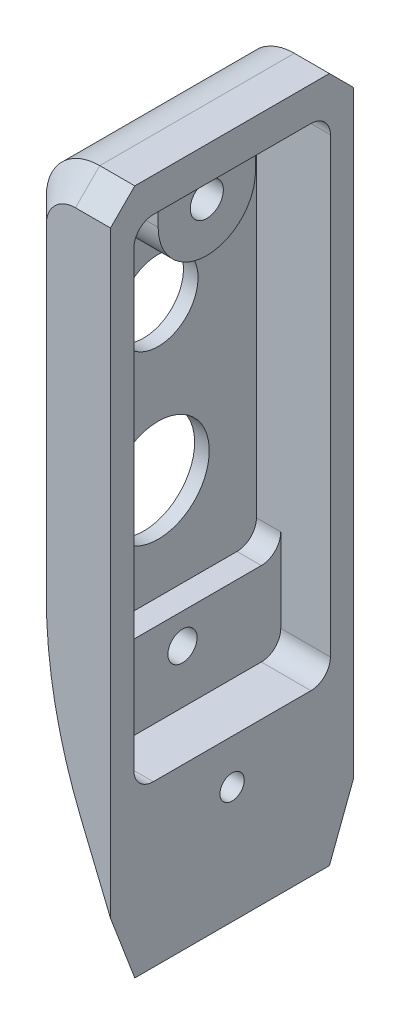
from build123d import *

# Parameters (mm, degrees)
EXTRUDE_1_DEPTH             = 25
CHAMFER_5_SIZE              = 2.5
SKETCH_6_W                  = 20.2
SKETCH_6_H                  = 41.891303575
CUT_EXTRUDE_2_DEPTH         = 7.6
SKETCH_7_R                  = 5.25
SKETCH_7_R_2                = 4.1
CUT_EXTRUDE_3_DEPTH         = 76.352903063
SKETCH_8_W                  = 20.2
SKETCH_8_H                  = 8.585894888
CUT_EXTRUDE_4_DEPTH         = 5.1
FILLET_2_R                  = 2
CUT_EXTRUDE_5_REACH         = 77.353
SKETCH_10_R                 = 1.5
M3X0_51_D                   = 2.5
M3X0_51_DEPTH               = 3
M3X0_51_TIP                 = 0.751075774
EXTRUDE_3_DEPTH             = 5
FILLET_3_R                  = 2
HOLE_WIZARD_M32_D           = 3.4
HOLE_WIZARD_M32_CBORE_D     = 6.5
HOLE_WIZARD_M32_CBORE_DEPTH = 2.5


with BuildPart() as part:
    # Эскиз1 → Бобышка-Вытянуть1 (new body)
    with BuildSketch(Plane.XY):
        with BuildLine():
            Line((0, 0), (0, 70.5))
            Line((0, 70.5), (-3.6, 70.5))
            ThreePointArc((-3.6, 70.5), (-7.489087297, 68.889087297), (-9.1, 65))
            Line((-9.1, 65), (-9.1, 32))
            ThreePointArc((-9.1, 32), (-8.15059166, 22.302605618), (-5.338421688, 12.97348272))
            Line((-5.338421688, 12.97348272), (0, 0))
        make_face()
    extrude(amount=EXTRUDE_1_DEPTH)

    # Фаска5
    chamfer_5_edges = [part.edges().sort_by_distance(p)[0] for p in [
        (-8.15059166, 22.302605618, 25),
        (-2.669210844, 6.48674136, 25),
        (-1.8, 70.5, 25),
        (-7.489087297, 68.889087297, 25),
        (-1.8, 70.5, 0),
        (-2.669210844, 6.48674136, 0),
        (-9.1, 48.5, 25),
        (-8.15059166, 22.302605618, 0),
        (-9.1, 48.5, 0),
        (-7.489087297, 68.889087297, 0),
    ]]
    chamfer(chamfer_5_edges, length=CHAMFER_5_SIZE)

    # Эскиз6 → Вырез-Вытянуть2 (cut)
    with BuildSketch(Plane(origin=(0, 0, 0), x_dir=(0, 0, -1), z_dir=(1, 0, 0))):
        with Locations((-12.5, 46.054348213)):
            Rectangle(SKETCH_6_W, SKETCH_6_H)
    extrude(amount=-CUT_EXTRUDE_2_DEPTH, mode=Mode.SUBTRACT)

    # Эскиз7 → Вырез-Вытянуть3 (cut, through all)
    with BuildSketch(Plane.ZY.offset(9.1)):
        with Locations(Location((12.5, 35.5, 0), (0, 0, 318.189685104))):
            Circle(SKETCH_7_R)
        with Locations((12.5, 51.5)):
            Circle(SKETCH_7_R_2)
    extrude(amount=-CUT_EXTRUDE_3_DEPTH, mode=Mode.SUBTRACT)

    # Эскиз8 → Вырез-Вытянуть4 (cut)
    with BuildSketch(Plane(origin=(0, 0, 0), x_dir=(0, 0, -1), z_dir=(1, 0, 0))):
        with Locations((-12.5, 20.815748981)):
            Rectangle(SKETCH_8_W, SKETCH_8_H)
    extrude(amount=-CUT_EXTRUDE_4_DEPTH, mode=Mode.SUBTRACT)

    # Скругление2
    fillet_2_edges = [part.edges().sort_by_distance(p)[0] for p in [
        (-3.8, 67, 2.4),
        (-6.35, 25.108696425, 2.4),
        (-6.35, 25.108696425, 22.6),
        (-3.8, 67, 22.6),
        (-2.55, 16.522801537, 22.6),
        (-2.55, 16.522801537, 2.4),
    ]]
    fillet(fillet_2_edges, radius=FILLET_2_R)

    # Эскиз10 → Вырез-Вытянуть5 (cut, up to next)
    with BuildSketch(Plane.ZY.offset(9.1), mode=Mode.PRIVATE) as cut_extrude_5_sk1:
        with Locations((12.5, 22)):
            Circle(SKETCH_10_R)
    cut_extrude_5_tool1 = extrude(cut_extrude_5_sk1.sketch, amount=-CUT_EXTRUDE_5_REACH, mode=Mode.PRIVATE) & part.part
    add(cut_extrude_5_tool1.solids().sort_by_distance((-9.1, 22, 12.5))[0], mode=Mode.SUBTRACT)

    # Отверстие обработанное метчиком M3x0.51
    with Locations(Plane(origin=(0, 0, 0), x_dir=(0, 0, -1), z_dir=(1, 0, 0))):
        with Locations((-12.5, 12)):
            Hole(M3X0_51_D / 2, depth=M3X0_51_DEPTH)
            with Locations((0, 0, -(M3X0_51_DEPTH + M3X0_51_TIP / 2))):  # 118° drill point
                Cone(0, M3X0_51_D / 2, M3X0_51_TIP, mode=Mode.SUBTRACT)

    # Эскиз22 → Бобышка-Вытянуть3 (add)
    with BuildSketch(Plane(origin=(-7.6, 0, 0), x_dir=(0, 0, -1), z_dir=(1, 0, 0))):
        with BuildLine():
            Line((-17.5, 63), (-17.5, 67))
            Line((-17.5, 67), (-7.5, 67))
            Line((-7.5, 67), (-7.5, 63))
            ThreePointArc((-7.5, 63), (-12.5, 58), (-17.5, 63))
        make_face()
    extrude(amount=EXTRUDE_3_DEPTH)

    # Скругление3
    fillet_3_edges = [part.edges().sort_by_distance(p)[0] for p in [
        (-5.1, 67, 7.5),
        (-5.1, 67, 17.5),
    ]]
    fillet(fillet_3_edges, radius=FILLET_3_R)

    # Цековка для винта с внутренним шестигранником M32 (through all)
    with Locations(Plane.ZY.offset(9.1)):
        with Locations((12.5, 63)):
            CounterBoreHole(HOLE_WIZARD_M32_D / 2, HOLE_WIZARD_M32_CBORE_D / 2, HOLE_WIZARD_M32_CBORE_DEPTH)


solid = part.part
